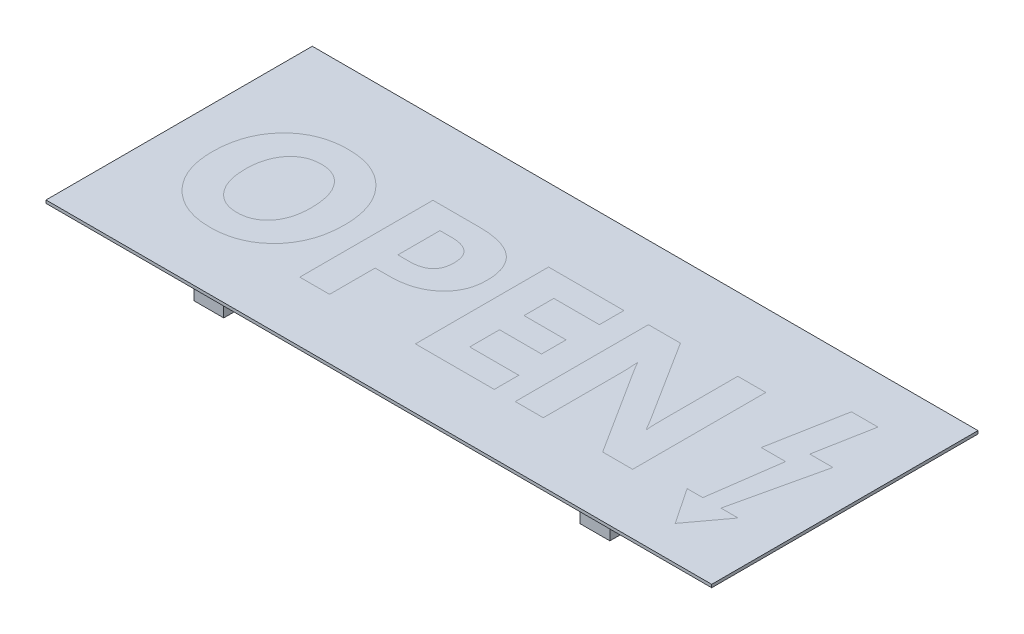
from build123d import *

# Parameters (mm, degrees)
TEXT_BORDER_W           = 200
TEXT_BORDER_H           = 80
BODY_DEPTH              = 0.9
BOLT_DEPTH              = 0.9
CUT_EXTRUDE3_DEPTH      = 3
LETTERS_DEPTH           = 0.9
LETTERS_2_DEPTH         = 0.9
LETTERS_3_DEPTH         = 0.9
LETTERS_4_DEPTH         = 0.9
SKETCH7_W               = 9
SKETCH7_H               = 9
MOUNT_TAB_DEPTH         = 10
SKETCH9_R               = 1.4
M3_SCREW_DEPTH          = 6
MIRROR2_COPY_1_SKETCH_W = 9
MIRROR2_COPY_1_SKETCH_H = 9
MIRROR2_COPY_1_DEPTH    = 10
MIRROR2_COPY_2_SKETCH_R = 1.4
MIRROR2_COPY_2_DEPTH    = 6


with BuildPart() as part:
    # Text / Border → Body (new body)
    with BuildSketch(Plane(origin=(0, 0, 0), x_dir=(1, 0, 0), z_dir=(0, 1, 0))):
        with Locations((100, 40)):
            Rectangle(TEXT_BORDER_W, TEXT_BORDER_H)
        Polygon((171.851348042, 43.030122805), (176.103970786, 65.881002111), (184.049348278, 65.881002111), (180.836570424, 48.617585305), (187.794493269, 48.617585305), (181.556439571, 21.214368392), (186.70625428, 21.214368392), (178.668181509, 10.358512154), (171.405722422, 21.214368392), (176.103970786, 21.214368392), (179.157361868, 43.030122805), align=None, mode=Mode.SUBTRACT)
    extrude(amount=BODY_DEPTH)

    # Sketch6 → Cut-Extrude3 (cut)
    # profile 1 of 4: a face of its own
    with BuildSketch(Plane(origin=(0, 0.9, 0), x_dir=(1, 0, 0), z_dir=(0, 1, 0))):
        with BuildLine():
            add(Edge.make_bspline(
                [(31.706662239, 17.518097153), (31.012417719, 17.536451887), (29.649318872, 17.572490078), (27.653989274, 17.826526683), (25.757158755, 18.265892427), (23.957976599, 18.87138244), (22.259196765, 19.661398129), (20.656600537, 20.615164877), (19.159906196, 21.755502332), (17.767500738, 23.04638463), (16.512000959, 24.483519105), (15.412832339, 26.037700457), (14.476929251, 27.693822053), (13.728921137, 29.465555056), (13.133130603, 31.333630545), (12.720723037, 33.309589038), (12.455465814, 35.386414955), (12.427971907, 36.807274127), (12.413899081, 37.534544522)],
                knots=[0, 0, 0, 0, 1.066514654, 2.094024304, 3.083949431, 4.053508208, 5.005063613, 5.95701037, 6.91302883, 7.890458477, 8.869429341, 9.839289914, 10.810402398, 11.785888464, 12.788834388, 13.818042923, 14.883159698, 16, 16, 16, 16], degree=3))
            add(Edge.make_bspline(
                [(12.413899081, 37.534544522), (12.427142558, 38.300261788), (12.453095309, 39.800809564), (12.731194249, 41.991052202), (13.136752545, 44.076090452), (13.74489067, 46.039656982), (14.507310484, 47.89878744), (15.460985618, 49.634272491), (16.567189324, 51.27208694), (17.848226818, 52.775681557), (19.262262831, 54.140536473), (20.806973647, 55.32469057), (22.454992438, 56.335462256), (24.224193678, 57.150345745), (26.09613485, 57.797086521), (28.084837564, 58.24392017), (30.180126111, 58.521766225), (31.615309671, 58.554178919), (32.348109607, 58.570728732)],
                knots=[0, 0, 0, 0, 1.12554662, 2.205692039, 3.242259702, 4.245908483, 5.223734231, 6.19255057, 7.153102442, 8.125652901, 9.092277335, 10.038164733, 10.982667815, 11.929628597, 12.897328609, 13.890001992, 14.922642057, 16, 16, 16, 16], degree=3))
            add(Edge.make_bspline(
                [(32.348109607, 58.570728732), (33.039653099, 58.552581254), (34.394649102, 58.517023461), (36.37860094, 58.260853364), (38.260523861, 57.826222531), (40.041030833, 57.214377857), (41.72327155, 56.43130898), (43.296826363, 55.462600265), (44.774806011, 54.327881029), (46.131615206, 53.021686665), (47.362045354, 51.579657037), (48.441857499, 50.018289855), (49.336219099, 48.33585442), (50.082954194, 46.550779145), (50.656373696, 44.651426437), (51.065353525, 42.642040933), (51.316572937, 40.523381963), (51.346156032, 39.073077979), (51.361267502, 38.33224189)],
                knots=[0, 0, 0, 0, 1.061845288, 2.080557679, 3.065951617, 4.023138676, 4.966648067, 5.909556233, 6.855120048, 7.822765862, 8.796245348, 9.761911246, 10.731870988, 11.716932167, 12.729003832, 13.77338215, 14.862611647, 16, 16, 16, 16], degree=3))
            add(Edge.make_bspline(
                [(51.361267502, 38.33224189), (51.346774983, 37.572175998), (51.318384252, 36.083212957), (51.057948588, 33.906666814), (50.634874923, 31.841142075), (50.031958015, 29.892010355), (49.265107411, 28.052811828), (48.325250687, 26.325554402), (47.20762243, 24.716098757), (45.936640487, 23.228671364), (44.524283647, 21.893985949), (43.005878595, 20.714884502), (41.375226788, 19.722365557), (39.639568487, 18.914727893), (37.800989535, 18.284972524), (35.859535994, 17.848172718), (33.817428055, 17.56625109), (32.420341185, 17.534378661), (31.706662239, 17.518097153)],
                knots=[0, 0, 0, 0, 1.132328248, 2.218222035, 3.261372295, 4.2705407, 5.253810636, 6.226363414, 7.195245697, 8.168733222, 9.136779753, 10.086262421, 11.028590864, 11.97529237, 12.933871248, 13.918904746, 14.936906574, 16, 16, 16, 16], degree=3))
        make_face()
        with BuildLine():
            add(Edge.make_bspline(
                [(32.093175397, 50.67599189), (31.711595213, 50.664170178), (30.967093409, 50.641104815), (29.877399485, 50.482870022), (28.84762316, 50.217677312), (27.885123808, 49.818764826), (26.971948736, 49.339251403), (26.129559612, 48.72863959), (25.343918196, 48.016968682), (24.622813312, 47.202635435), (23.973854806, 46.299661641), (23.414271824, 45.317255673), (22.94586478, 44.266181355), (22.556689828, 43.146933614), (22.253421038, 41.955770067), (22.044856495, 40.692777519), (21.907126231, 39.36325551), (21.89420507, 38.453218744), (21.887583291, 37.986847153)],
                knots=[0, 0, 0, 0, 0.999383284, 1.949898576, 2.878239443, 3.77697613, 4.673299942, 5.573985174, 6.494153057, 7.445291985, 8.417767725, 9.401943952, 10.401533592, 11.427998165, 12.502564195, 13.616962893, 14.77875175, 16, 16, 16, 16], degree=3))
            add(Edge.make_bspline(
                [(21.887583291, 37.986847153), (21.894254902, 37.515000057), (21.907276732, 36.594036179), (22.043862583, 35.253456958), (22.251953507, 33.98735091), (22.559905322, 32.797576924), (22.942779909, 31.679037287), (23.410296369, 30.634630061), (23.976901724, 29.672594518), (24.620086966, 28.789523995), (25.338796568, 27.997751073), (26.109076475, 27.302594267), (26.942888548, 26.721602918), (27.824573823, 26.242061265), (28.760516885, 25.868872359), (29.749314961, 25.608737911), (30.790445031, 25.434886759), (31.505822184, 25.42028865), (31.871135923, 25.412833996)],
                knots=[0, 0, 0, 0, 1.254202876, 2.447986969, 3.579160536, 4.662840844, 5.711642924, 6.719633901, 7.699699477, 8.675010393, 9.619324756, 10.538175985, 11.427887183, 12.314997099, 13.201537904, 14.09971778, 15.029603896, 16, 16, 16, 16], degree=3))
            add(Edge.make_bspline(
                [(31.871135923, 25.412833996), (32.247317226, 25.420913267), (32.981191614, 25.436674737), (34.049745159, 25.600350407), (35.06098328, 25.850826953), (36.009500271, 26.215355094), (36.900285936, 26.678544027), (37.725172783, 27.251934018), (38.49660974, 27.922814885), (39.201905579, 28.696140088), (39.832576165, 29.560897403), (40.390344452, 30.50274446), (40.846362771, 31.532892187), (41.236930354, 32.636163574), (41.530650108, 33.823605918), (41.729283471, 35.089669863), (41.868449425, 36.429498101), (41.881101249, 37.350504558), (41.887583291, 37.822373469)],
                knots=[0, 0, 0, 0, 1.00217265, 1.955091423, 2.875015528, 3.774864866, 4.657455052, 5.545354462, 6.446656772, 7.377747269, 8.329319954, 9.295679398, 10.29001399, 11.327793258, 12.4125512, 13.545522493, 14.742471758, 16, 16, 16, 16], degree=3))
            add(Edge.make_bspline(
                [(41.887583291, 37.822373469), (41.880246193, 38.316073024), (41.86599596, 39.274944405), (41.739697096, 40.673202185), (41.53809899, 41.987211375), (41.253371767, 43.2177733), (40.877523473, 44.359398348), (40.44162145, 45.425990342), (39.901611949, 46.402330965), (39.283570961, 47.289164554), (38.60719459, 48.093021295), (37.848756859, 48.777886232), (37.041190759, 49.367964801), (36.168724441, 49.849905602), (35.234208397, 50.221073929), (34.239537073, 50.479949208), (33.187562676, 50.654401055), (32.463978749, 50.668676423), (32.093175397, 50.67599189)],
                knots=[0, 0, 0, 0, 1.299402741, 2.523721339, 3.692309641, 4.796776925, 5.844208707, 6.853356801, 7.825499763, 8.774330453, 9.695566542, 10.584351255, 11.457621121, 12.323224798, 13.200925798, 14.09712034, 15.024862037, 16, 16, 16, 16], degree=3))
        make_face(mode=Mode.SUBTRACT)
    # profile 2 of 4: a face of its own
    with BuildSketch(Plane(origin=(0, 0.9, 0), x_dir=(1, 0, 0), z_dir=(0, 1, 0))):
        with BuildLine():
            Line((67.150741186, 31.728623469), (67.150741186, 18.044412943))
            Line((67.150741186, 18.044412943), (58.203372765, 18.044412943))
            Line((58.203372765, 18.044412943), (58.203372765, 58.044412943))
            Line((58.203372765, 58.044412943), (72.183635923, 58.044412943))
            add(Edge.make_bspline(
                [(72.183635923, 58.044412943), (72.786973643, 58.035165772), (73.959927726, 58.017188267), (75.661639404, 57.872288276), (77.243518683, 57.615717244), (78.712213034, 57.275560008), (80.062047511, 56.825112436), (81.297309787, 56.273022995), (82.416145486, 55.622007237), (83.418437154, 54.869094965), (84.309754058, 54.01895092), (85.06587927, 53.055210503), (85.716709728, 52.00071263), (86.241312942, 50.841520055), (86.652041903, 49.583723459), (86.948075115, 48.22594633), (87.119176542, 46.768670922), (87.140031999, 45.764168142), (87.150741186, 45.248360311)],
                knots=[0, 0, 0, 0, 1.284087379, 2.496405386, 3.631154652, 4.692553255, 5.701802642, 6.655004168, 7.567628257, 8.450986155, 9.317535919, 10.181370761, 11.050959787, 11.949107902, 12.882715444, 13.862370954, 14.902336735, 16, 16, 16, 16], degree=3))
            add(Edge.make_bspline(
                [(87.150741186, 45.248360311), (87.139588075, 44.756848621), (87.11767779, 43.791273946), (86.901462572, 42.38216196), (86.579627194, 41.039556483), (86.107749157, 39.77198953), (85.491965406, 38.580598046), (84.749760746, 37.456425399), (83.870624077, 36.407771827), (82.869600599, 35.437276978), (81.749708544, 34.572878232), (80.545303061, 33.797397325), (79.238856455, 33.156199694), (77.841469143, 32.642746248), (76.360309081, 32.226828357), (74.789150233, 31.93449603), (73.12512248, 31.759681491), (71.986703847, 31.739157731), (71.402385923, 31.728623469)],
                knots=[0, 0, 0, 0, 1.009530422, 1.983222427, 2.923376185, 3.843289395, 4.755474871, 5.674317712, 6.606349661, 7.562639691, 8.534144905, 9.509449375, 10.502222218, 11.518412659, 12.565542477, 13.660624897, 14.799265258, 16, 16, 16, 16], degree=3))
            Line((71.402385923, 31.728623469), (67.150741186, 31.728623469))
        make_face()
        with BuildLine():
            Line((67.150741186, 51.20230768), (67.150741186, 38.570728732))
            Line((67.150741186, 38.570728732), (70.621135923, 38.570728732))
            add(Edge.make_bspline(
                [(70.621135923, 38.570728732), (70.906425693, 38.574994603), (71.458834816, 38.583254647), (72.260822791, 38.660192919), (73.00824471, 38.775648181), (73.696156263, 38.963064465), (74.333489159, 39.182531597), (74.922320622, 39.450640904), (75.447477357, 39.783795201), (75.926009319, 40.154094402), (76.338648071, 40.585687711), (76.690878153, 41.067548234), (77.003389336, 41.589708166), (77.244880549, 42.170595632), (77.445061439, 42.797069379), (77.582100871, 43.47533442), (77.665887992, 44.201813765), (77.673260217, 44.702614678), (77.677056976, 44.960531364)],
                knots=[0, 0, 0, 0, 1.254330802, 2.428771901, 3.540659339, 4.575849776, 5.559566444, 6.503471629, 7.413349546, 8.288873832, 9.158568442, 10.029014769, 10.90983528, 11.827982094, 12.788827193, 13.798428848, 14.866172325, 16, 16, 16, 16], degree=3))
            add(Edge.make_bspline(
                [(77.677056976, 44.960531364), (77.67326125, 45.212967569), (77.665895337, 45.702840463), (77.582227363, 46.412999352), (77.444873395, 47.074758672), (77.245722246, 47.685446665), (76.998594614, 48.25233293), (76.695716786, 48.769100695), (76.338363376, 49.237906193), (75.920078932, 49.650861645), (75.452937412, 50.025233239), (74.916878667, 50.335671524), (74.333984592, 50.606948498), (73.698544461, 50.830950067), (73.005437758, 50.991596509), (72.261253813, 51.114594582), (71.458715846, 51.189298431), (70.906385176, 51.197877203), (70.621135923, 51.20230768)],
                knots=[0, 0, 0, 0, 1.12176303, 2.176871983, 3.173568906, 4.121620514, 5.027372624, 5.917745259, 6.778174381, 7.639897057, 8.524916032, 9.431978927, 10.386120364, 11.380505021, 12.420943713, 13.544889099, 14.732066513, 16, 16, 16, 16], degree=3))
            Line((70.621135923, 51.20230768), (67.150741186, 51.20230768))
        make_face(mode=Mode.SUBTRACT)
    # profile 3 of 4: a face of its own
    with BuildSketch(Plane(origin=(0, 0.9, 0), x_dir=(1, 0, 0), z_dir=(0, 1, 0))):
        Polygon((116.624425397, 18.044412943), (92.94021487, 18.044412943), (92.94021487, 58.044412943), (115.571793818, 58.044412943), (115.571793818, 50.67599189), (101.887583291, 50.67599189), (101.887583291, 41.728623469), (114.519162239, 41.728623469), (114.519162239, 34.360202417), (101.887583291, 34.360202417), (101.887583291, 25.412833996), (116.624425397, 25.412833996), align=None)
    # profile 4 of 4: a face of its own
    with BuildSketch(Plane(origin=(0, 0.9, 0), x_dir=(1, 0, 0), z_dir=(0, 1, 0))):
        with BuildLine():
            Line((158.203372765, 18.044412943), (149.198438555, 18.044412943))
            Line((149.198438555, 18.044412943), (133.195149081, 43.17599189))
            add(Edge.make_bspline(
                [(133.195149081, 43.17599189), (132.977844838, 43.520906819), (132.574349893, 44.161351888), (132.025876048, 45.055792593), (131.598592666, 45.821709199), (131.354897472, 46.289558452), (131.246135923, 46.498360311)],
                knots=[0, 0, 0, 0, 1.269529073, 2.357287452, 3.266854799, 4, 4, 4, 4], degree=3))
            Line((131.246135923, 46.498360311), (131.139228028, 46.498360311))
            add(Edge.make_bspline(
                [(131.139228028, 46.498360311), (131.155729018, 46.309227574), (131.190630539, 45.90918974), (131.244900747, 45.273797886), (131.270277579, 44.568485234), (131.307137706, 43.795752213), (131.330944382, 42.954058725), (131.343975314, 42.041119458), (131.366076863, 41.057108539), (131.362904659, 40.377211737), (131.361267502, 40.026320838)],
                knots=[0, 0, 0, 0, 0.703373645, 1.487717424, 2.362034454, 3.317515189, 4.353823942, 5.481267207, 6.700096234, 8, 8, 8, 8], degree=3))
            Line((131.361267502, 40.026320838), (131.361267502, 18.044412943))
            Line((131.361267502, 18.044412943), (122.94021487, 18.044412943))
            Line((122.94021487, 18.044412943), (122.94021487, 58.044412943))
            Line((122.94021487, 58.044412943), (132.553701712, 58.044412943))
            Line((132.553701712, 58.044412943), (147.948438555, 33.694083996))
            add(Edge.make_bspline(
                [(147.948438555, 33.694083996), (148.289957352, 33.151174026), (148.965007868, 32.07805109), (149.589098475, 30.974519006), (149.897451712, 30.429281364)],
                knots=[0, 0, 0, 0, 1.011831825, 2, 2, 2, 2], degree=3))
            Line((149.897451712, 30.429281364), (150.004359607, 30.429281364))
            add(Edge.make_bspline(
                [(150.004359607, 30.429281364), (149.987574948, 30.560810543), (149.950558044, 30.850885119), (149.89796967, 31.32736329), (149.872600709, 31.887643769), (149.835570683, 32.53147551), (149.812582752, 33.260853401), (149.799403689, 34.075113595), (149.777403963, 34.971401419), (149.780634274, 35.596480994), (149.782320134, 35.922702417)],
                knots=[0, 0, 0, 0, 0.578464698, 1.275746594, 2.090315676, 3.02428766, 4.089179563, 5.273291421, 6.576963981, 8, 8, 8, 8], degree=3))
            Line((149.782320134, 35.922702417), (149.782320134, 58.044412943))
            Line((149.782320134, 58.044412943), (158.203372765, 58.044412943))
            Line((158.203372765, 58.044412943), (158.203372765, 18.044412943))
        make_face()
    extrude(amount=-CUT_EXTRUDE3_DEPTH, mode=Mode.SUBTRACT)


with BuildPart() as body_2:
    # Text / Border<9> → Bolt (new body)
    with BuildSketch(Plane(origin=(0, 0, 0), x_dir=(1, 0, 0), z_dir=(0, 1, 0))):
        Polygon((184.049348278, 65.881002111), (176.103970786, 65.881002111), (171.851348042, 43.030122805), (179.157361868, 43.030122805), (176.103970786, 21.214368392), (171.405722422, 21.214368392), (178.668181509, 10.358512154), (186.70625428, 21.214368392), (181.556439571, 21.214368392), (187.794493269, 48.617585305), (180.836570424, 48.617585305), align=None)
    extrude(amount=BOLT_DEPTH)


with BuildPart() as cut_extrude3_piece_1:
    # of the separate pieces the step leaves, piece 1, a body of its own (cut_extrude3_pieces)
    add(part.part.solids().sort_by_distance((0, 0, -80))[0])

    # Sketch7 → Mount Tab (add)
    with BuildSketch(Plane.XZ):
        with Locations((42, -11.4)):
            Rectangle(SKETCH7_W, SKETCH7_H)
    mount_tab = extrude(amount=MOUNT_TAB_DEPTH)

    # Sketch9 → M3 Screw (cut)
    with BuildSketch(Plane.XY.offset(-6.9)):
        with Locations((42, -5.5)):
            Circle(SKETCH9_R)
    m3_screw = extrude(amount=-M3_SCREW_DEPTH, mode=Mode.SUBTRACT)

    # Mirror1: Mount Tab, M3 Screw across plane
    add(mount_tab.mirror(Plane.ZY.offset(-100)))
    add(m3_screw.mirror(Plane.ZY.offset(-100)), mode=Mode.SUBTRACT)

    # Mirror2: Mount Tab, M3 Screw across plane
    add(mount_tab.mirror(Plane.XY.offset(-39.651328256)))
    add(m3_screw.mirror(Plane.XY.offset(-39.651328256)), mode=Mode.SUBTRACT)

    # Mirror2 copy 1 sketch → Mirror2 copy 1 (add)
    with BuildSketch(Plane(origin=(200, 0, -79.302656511), x_dir=(-1, 0, 0), z_dir=(0, -1, 0))):
        with Locations((42, -11.4)):
            Rectangle(MIRROR2_COPY_1_SKETCH_W, MIRROR2_COPY_1_SKETCH_H)
    extrude(amount=MIRROR2_COPY_1_DEPTH)

    # Mirror2 copy 2 sketch → Mirror2 copy 2 (cut)
    with BuildSketch(Plane(origin=(200, 0, -72.402656511), x_dir=(-1, 0, 0), z_dir=(0, 0, -1))):
        with Locations((42, -5.5)):
            Circle(MIRROR2_COPY_2_SKETCH_R)
    extrude(amount=-MIRROR2_COPY_2_DEPTH, mode=Mode.SUBTRACT)


with BuildPart() as cut_extrude3_piece_2:
    # of the separate pieces the step leaves, piece 2, a body of its own (cut_extrude3_pieces)
    add(part.part.solids().sort_by_distance((21.887583291, 0, -37.986847153))[0])


with BuildPart() as cut_extrude3_piece_3:
    # of the separate pieces the step leaves, piece 3, a body of its own (cut_extrude3_pieces)
    add(part.part.solids().sort_by_distance((70.621135923, 0, -51.20230768))[0])


with BuildPart() as body_5:
    # Sketch6<2> → Letters (new body)
    with BuildSketch(Plane(origin=(0, 0.9, 0), x_dir=(1, 0, 0), z_dir=(0, 1, 0))):
        with BuildLine():
            add(Edge.make_bspline(
                [(31.706662239, 17.518097153), (31.012417719, 17.536451887), (29.649318872, 17.572490078), (27.653989274, 17.826526683), (25.757158755, 18.265892427), (23.957976599, 18.87138244), (22.259196765, 19.661398129), (20.656600537, 20.615164877), (19.159906196, 21.755502332), (17.767500738, 23.04638463), (16.512000959, 24.483519105), (15.412832339, 26.037700457), (14.476929251, 27.693822053), (13.728921137, 29.465555056), (13.133130603, 31.333630545), (12.720723037, 33.309589038), (12.455465814, 35.386414955), (12.427971907, 36.807274127), (12.413899081, 37.534544522)],
                knots=[0, 0, 0, 0, 1.066514654, 2.094024304, 3.083949431, 4.053508208, 5.005063613, 5.95701037, 6.91302883, 7.890458477, 8.869429341, 9.839289914, 10.810402398, 11.785888464, 12.788834388, 13.818042923, 14.883159698, 16, 16, 16, 16], degree=3))
            add(Edge.make_bspline(
                [(12.413899081, 37.534544522), (12.427142558, 38.300261788), (12.453095309, 39.800809564), (12.731194249, 41.991052202), (13.136752545, 44.076090452), (13.74489067, 46.039656982), (14.507310484, 47.89878744), (15.460985618, 49.634272491), (16.567189324, 51.27208694), (17.848226818, 52.775681557), (19.262262831, 54.140536473), (20.806973647, 55.32469057), (22.454992438, 56.335462256), (24.224193678, 57.150345745), (26.09613485, 57.797086521), (28.084837564, 58.24392017), (30.180126111, 58.521766225), (31.615309671, 58.554178919), (32.348109607, 58.570728732)],
                knots=[0, 0, 0, 0, 1.12554662, 2.205692039, 3.242259702, 4.245908483, 5.223734231, 6.19255057, 7.153102442, 8.125652901, 9.092277335, 10.038164733, 10.982667815, 11.929628597, 12.897328609, 13.890001992, 14.922642057, 16, 16, 16, 16], degree=3))
            add(Edge.make_bspline(
                [(32.348109607, 58.570728732), (33.039653099, 58.552581254), (34.394649102, 58.517023461), (36.37860094, 58.260853364), (38.260523861, 57.826222531), (40.041030833, 57.214377857), (41.72327155, 56.43130898), (43.296826363, 55.462600265), (44.774806011, 54.327881029), (46.131615206, 53.021686665), (47.362045354, 51.579657037), (48.441857499, 50.018289855), (49.336219099, 48.33585442), (50.082954194, 46.550779145), (50.656373696, 44.651426437), (51.065353525, 42.642040933), (51.316572937, 40.523381963), (51.346156032, 39.073077979), (51.361267502, 38.33224189)],
                knots=[0, 0, 0, 0, 1.061845288, 2.080557679, 3.065951617, 4.023138676, 4.966648067, 5.909556233, 6.855120048, 7.822765862, 8.796245348, 9.761911246, 10.731870988, 11.716932167, 12.729003832, 13.77338215, 14.862611647, 16, 16, 16, 16], degree=3))
            add(Edge.make_bspline(
                [(51.361267502, 38.33224189), (51.346774983, 37.572175998), (51.318384252, 36.083212957), (51.057948588, 33.906666814), (50.634874923, 31.841142075), (50.031958015, 29.892010355), (49.265107411, 28.052811828), (48.325250687, 26.325554402), (47.20762243, 24.716098757), (45.936640487, 23.228671364), (44.524283647, 21.893985949), (43.005878595, 20.714884502), (41.375226788, 19.722365557), (39.639568487, 18.914727893), (37.800989535, 18.284972524), (35.859535994, 17.848172718), (33.817428055, 17.56625109), (32.420341185, 17.534378661), (31.706662239, 17.518097153)],
                knots=[0, 0, 0, 0, 1.132328248, 2.218222035, 3.261372295, 4.2705407, 5.253810636, 6.226363414, 7.195245697, 8.168733222, 9.136779753, 10.086262421, 11.028590864, 11.97529237, 12.933871248, 13.918904746, 14.936906574, 16, 16, 16, 16], degree=3))
        make_face()
        with BuildLine():
            add(Edge.make_bspline(
                [(32.093175397, 50.67599189), (31.711595213, 50.664170178), (30.967093409, 50.641104815), (29.877399485, 50.482870022), (28.84762316, 50.217677312), (27.885123808, 49.818764826), (26.971948736, 49.339251403), (26.129559612, 48.72863959), (25.343918196, 48.016968682), (24.622813312, 47.202635435), (23.973854806, 46.299661641), (23.414271824, 45.317255673), (22.94586478, 44.266181355), (22.556689828, 43.146933614), (22.253421038, 41.955770067), (22.044856495, 40.692777519), (21.907126231, 39.36325551), (21.89420507, 38.453218744), (21.887583291, 37.986847153)],
                knots=[0, 0, 0, 0, 0.999383284, 1.949898576, 2.878239443, 3.77697613, 4.673299942, 5.573985174, 6.494153057, 7.445291985, 8.417767725, 9.401943952, 10.401533592, 11.427998165, 12.502564195, 13.616962893, 14.77875175, 16, 16, 16, 16], degree=3))
            add(Edge.make_bspline(
                [(21.887583291, 37.986847153), (21.894254902, 37.515000057), (21.907276732, 36.594036179), (22.043862583, 35.253456958), (22.251953507, 33.98735091), (22.559905322, 32.797576924), (22.942779909, 31.679037287), (23.410296369, 30.634630061), (23.976901724, 29.672594518), (24.620086966, 28.789523995), (25.338796568, 27.997751073), (26.109076475, 27.302594267), (26.942888548, 26.721602918), (27.824573823, 26.242061265), (28.760516885, 25.868872359), (29.749314961, 25.608737911), (30.790445031, 25.434886759), (31.505822184, 25.42028865), (31.871135923, 25.412833996)],
                knots=[0, 0, 0, 0, 1.254202876, 2.447986969, 3.579160536, 4.662840844, 5.711642924, 6.719633901, 7.699699477, 8.675010393, 9.619324756, 10.538175985, 11.427887183, 12.314997099, 13.201537904, 14.09971778, 15.029603896, 16, 16, 16, 16], degree=3))
            add(Edge.make_bspline(
                [(31.871135923, 25.412833996), (32.247317226, 25.420913267), (32.981191614, 25.436674737), (34.049745159, 25.600350407), (35.06098328, 25.850826953), (36.009500271, 26.215355094), (36.900285936, 26.678544027), (37.725172783, 27.251934018), (38.49660974, 27.922814885), (39.201905579, 28.696140088), (39.832576165, 29.560897403), (40.390344452, 30.50274446), (40.846362771, 31.532892187), (41.236930354, 32.636163574), (41.530650108, 33.823605918), (41.729283471, 35.089669863), (41.868449425, 36.429498101), (41.881101249, 37.350504558), (41.887583291, 37.822373469)],
                knots=[0, 0, 0, 0, 1.00217265, 1.955091423, 2.875015528, 3.774864866, 4.657455052, 5.545354462, 6.446656772, 7.377747269, 8.329319954, 9.295679398, 10.29001399, 11.327793258, 12.4125512, 13.545522493, 14.742471758, 16, 16, 16, 16], degree=3))
            add(Edge.make_bspline(
                [(41.887583291, 37.822373469), (41.880246193, 38.316073024), (41.86599596, 39.274944405), (41.739697096, 40.673202185), (41.53809899, 41.987211375), (41.253371767, 43.2177733), (40.877523473, 44.359398348), (40.44162145, 45.425990342), (39.901611949, 46.402330965), (39.283570961, 47.289164554), (38.60719459, 48.093021295), (37.848756859, 48.777886232), (37.041190759, 49.367964801), (36.168724441, 49.849905602), (35.234208397, 50.221073929), (34.239537073, 50.479949208), (33.187562676, 50.654401055), (32.463978749, 50.668676423), (32.093175397, 50.67599189)],
                knots=[0, 0, 0, 0, 1.299402741, 2.523721339, 3.692309641, 4.796776925, 5.844208707, 6.853356801, 7.825499763, 8.774330453, 9.695566542, 10.584351255, 11.457621121, 12.323224798, 13.200925798, 14.09712034, 15.024862037, 16, 16, 16, 16], degree=3))
        make_face(mode=Mode.SUBTRACT)
    extrude(amount=-LETTERS_DEPTH)


with BuildPart() as body_6:
    # Sketch6<2> → Letters 2 (new body)
    with BuildSketch(Plane(origin=(0, 0.9, 0), x_dir=(1, 0, 0), z_dir=(0, 1, 0))):
        with BuildLine():
            Line((67.150741186, 31.728623469), (67.150741186, 18.044412943))
            Line((67.150741186, 18.044412943), (58.203372765, 18.044412943))
            Line((58.203372765, 18.044412943), (58.203372765, 58.044412943))
            Line((58.203372765, 58.044412943), (72.183635923, 58.044412943))
            add(Edge.make_bspline(
                [(72.183635923, 58.044412943), (72.786973643, 58.035165772), (73.959927726, 58.017188267), (75.661639404, 57.872288276), (77.243518683, 57.615717244), (78.712213034, 57.275560008), (80.062047511, 56.825112436), (81.297309787, 56.273022995), (82.416145486, 55.622007237), (83.418437154, 54.869094965), (84.309754058, 54.01895092), (85.06587927, 53.055210503), (85.716709728, 52.00071263), (86.241312942, 50.841520055), (86.652041903, 49.583723459), (86.948075115, 48.22594633), (87.119176542, 46.768670922), (87.140031999, 45.764168142), (87.150741186, 45.248360311)],
                knots=[0, 0, 0, 0, 1.284087379, 2.496405386, 3.631154652, 4.692553255, 5.701802642, 6.655004168, 7.567628257, 8.450986155, 9.317535919, 10.181370761, 11.050959787, 11.949107902, 12.882715444, 13.862370954, 14.902336735, 16, 16, 16, 16], degree=3))
            add(Edge.make_bspline(
                [(87.150741186, 45.248360311), (87.139588075, 44.756848621), (87.11767779, 43.791273946), (86.901462572, 42.38216196), (86.579627194, 41.039556483), (86.107749157, 39.77198953), (85.491965406, 38.580598046), (84.749760746, 37.456425399), (83.870624077, 36.407771827), (82.869600599, 35.437276978), (81.749708544, 34.572878232), (80.545303061, 33.797397325), (79.238856455, 33.156199694), (77.841469143, 32.642746248), (76.360309081, 32.226828357), (74.789150233, 31.93449603), (73.12512248, 31.759681491), (71.986703847, 31.739157731), (71.402385923, 31.728623469)],
                knots=[0, 0, 0, 0, 1.009530422, 1.983222427, 2.923376185, 3.843289395, 4.755474871, 5.674317712, 6.606349661, 7.562639691, 8.534144905, 9.509449375, 10.502222218, 11.518412659, 12.565542477, 13.660624897, 14.799265258, 16, 16, 16, 16], degree=3))
            Line((71.402385923, 31.728623469), (67.150741186, 31.728623469))
        make_face()
        with BuildLine():
            Line((67.150741186, 51.20230768), (67.150741186, 38.570728732))
            Line((67.150741186, 38.570728732), (70.621135923, 38.570728732))
            add(Edge.make_bspline(
                [(70.621135923, 38.570728732), (70.906425693, 38.574994603), (71.458834816, 38.583254647), (72.260822791, 38.660192919), (73.00824471, 38.775648181), (73.696156263, 38.963064465), (74.333489159, 39.182531597), (74.922320622, 39.450640904), (75.447477357, 39.783795201), (75.926009319, 40.154094402), (76.338648071, 40.585687711), (76.690878153, 41.067548234), (77.003389336, 41.589708166), (77.244880549, 42.170595632), (77.445061439, 42.797069379), (77.582100871, 43.47533442), (77.665887992, 44.201813765), (77.673260217, 44.702614678), (77.677056976, 44.960531364)],
                knots=[0, 0, 0, 0, 1.254330802, 2.428771901, 3.540659339, 4.575849776, 5.559566444, 6.503471629, 7.413349546, 8.288873832, 9.158568442, 10.029014769, 10.90983528, 11.827982094, 12.788827193, 13.798428848, 14.866172325, 16, 16, 16, 16], degree=3))
            add(Edge.make_bspline(
                [(77.677056976, 44.960531364), (77.67326125, 45.212967569), (77.665895337, 45.702840463), (77.582227363, 46.412999352), (77.444873395, 47.074758672), (77.245722246, 47.685446665), (76.998594614, 48.25233293), (76.695716786, 48.769100695), (76.338363376, 49.237906193), (75.920078932, 49.650861645), (75.452937412, 50.025233239), (74.916878667, 50.335671524), (74.333984592, 50.606948498), (73.698544461, 50.830950067), (73.005437758, 50.991596509), (72.261253813, 51.114594582), (71.458715846, 51.189298431), (70.906385176, 51.197877203), (70.621135923, 51.20230768)],
                knots=[0, 0, 0, 0, 1.12176303, 2.176871983, 3.173568906, 4.121620514, 5.027372624, 5.917745259, 6.778174381, 7.639897057, 8.524916032, 9.431978927, 10.386120364, 11.380505021, 12.420943713, 13.544889099, 14.732066513, 16, 16, 16, 16], degree=3))
            Line((70.621135923, 51.20230768), (67.150741186, 51.20230768))
        make_face(mode=Mode.SUBTRACT)
    extrude(amount=-LETTERS_2_DEPTH)


with BuildPart() as body_7:
    # Sketch6<2> → Letters 3 (new body)
    with BuildSketch(Plane(origin=(0, 0.9, 0), x_dir=(1, 0, 0), z_dir=(0, 1, 0))):
        Polygon((116.624425397, 18.044412943), (92.94021487, 18.044412943), (92.94021487, 58.044412943), (115.571793818, 58.044412943), (115.571793818, 50.67599189), (101.887583291, 50.67599189), (101.887583291, 41.728623469), (114.519162239, 41.728623469), (114.519162239, 34.360202417), (101.887583291, 34.360202417), (101.887583291, 25.412833996), (116.624425397, 25.412833996), align=None)
    extrude(amount=-LETTERS_3_DEPTH)


with BuildPart() as body_8:
    # Sketch6<2> → Letters 4 (new body)
    with BuildSketch(Plane(origin=(0, 0.9, 0), x_dir=(1, 0, 0), z_dir=(0, 1, 0))):
        with BuildLine():
            Line((158.203372765, 18.044412943), (149.198438555, 18.044412943))
            Line((149.198438555, 18.044412943), (133.195149081, 43.17599189))
            add(Edge.make_bspline(
                [(133.195149081, 43.17599189), (132.977844838, 43.520906819), (132.574349893, 44.161351888), (132.025876048, 45.055792593), (131.598592666, 45.821709199), (131.354897472, 46.289558452), (131.246135923, 46.498360311)],
                knots=[0, 0, 0, 0, 1.269529073, 2.357287452, 3.266854799, 4, 4, 4, 4], degree=3))
            Line((131.246135923, 46.498360311), (131.139228028, 46.498360311))
            add(Edge.make_bspline(
                [(131.139228028, 46.498360311), (131.155729018, 46.309227574), (131.190630539, 45.90918974), (131.244900747, 45.273797886), (131.270277579, 44.568485234), (131.307137706, 43.795752213), (131.330944382, 42.954058725), (131.343975314, 42.041119458), (131.366076863, 41.057108539), (131.362904659, 40.377211737), (131.361267502, 40.026320838)],
                knots=[0, 0, 0, 0, 0.703373645, 1.487717424, 2.362034454, 3.317515189, 4.353823942, 5.481267207, 6.700096234, 8, 8, 8, 8], degree=3))
            Line((131.361267502, 40.026320838), (131.361267502, 18.044412943))
            Line((131.361267502, 18.044412943), (122.94021487, 18.044412943))
            Line((122.94021487, 18.044412943), (122.94021487, 58.044412943))
            Line((122.94021487, 58.044412943), (132.553701712, 58.044412943))
            Line((132.553701712, 58.044412943), (147.948438555, 33.694083996))
            add(Edge.make_bspline(
                [(147.948438555, 33.694083996), (148.289957352, 33.151174026), (148.965007868, 32.07805109), (149.589098475, 30.974519006), (149.897451712, 30.429281364)],
                knots=[0, 0, 0, 0, 1.011831825, 2, 2, 2, 2], degree=3))
            Line((149.897451712, 30.429281364), (150.004359607, 30.429281364))
            add(Edge.make_bspline(
                [(150.004359607, 30.429281364), (149.987574948, 30.560810543), (149.950558044, 30.850885119), (149.89796967, 31.32736329), (149.872600709, 31.887643769), (149.835570683, 32.53147551), (149.812582752, 33.260853401), (149.799403689, 34.075113595), (149.777403963, 34.971401419), (149.780634274, 35.596480994), (149.782320134, 35.922702417)],
                knots=[0, 0, 0, 0, 0.578464698, 1.275746594, 2.090315676, 3.02428766, 4.089179563, 5.273291421, 6.576963981, 8, 8, 8, 8], degree=3))
            Line((149.782320134, 35.922702417), (149.782320134, 58.044412943))
            Line((149.782320134, 58.044412943), (158.203372765, 58.044412943))
            Line((158.203372765, 58.044412943), (158.203372765, 18.044412943))
        make_face()
    extrude(amount=-LETTERS_4_DEPTH)


solid = Compound([body_2.part, cut_extrude3_piece_1.part, cut_extrude3_piece_2.part, cut_extrude3_piece_3.part, body_5.part, body_6.part, body_7.part, body_8.part])
